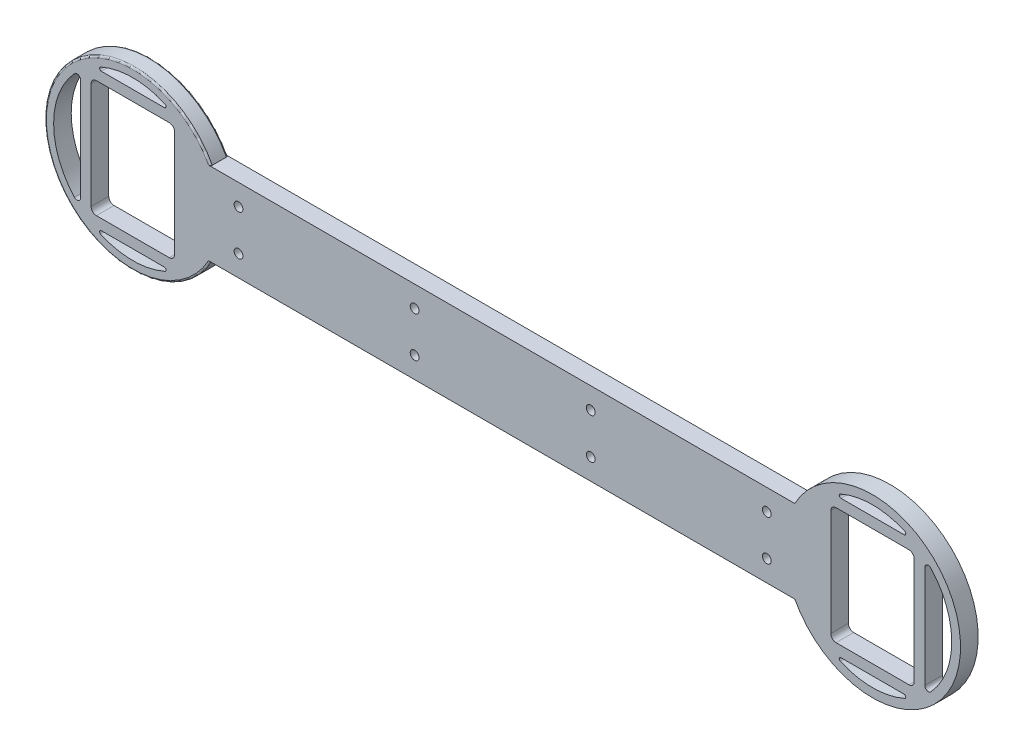
from build123d import *

# Parameters (mm, degrees)
SKETCH_1_W             = 47.4
SKETCH_1_H             = 66.4
SKETCH_1_R             = 2.5
EXTRUDE_1_DEPTH        = 10
FILLET_1_R             = 3
FILLET_2_R             = 2
FILLET_4_R             = 1
FILLET_5_R             = 1
FILLET_1_OF_MIRROR_1_R = 3
FILLET_2_OF_MIRROR_1_R = 2
FILLET_4_OF_MIRROR_1_R = 1


with BuildPart() as part:
    # 草图1 → 凸台-拉伸1 (new body)
    with BuildSketch(Plane.XY):
        with BuildLine():
            ThreePointArc((-165.866679255, 23.5), (-260, 0), (-165.866679255, -23.5))
            Line((-165.866679255, -23.5), (0, -23.5))
            Line((0, -23.5), (0, 23.5))
            Line((0, 23.5), (-165.866679255, 23.5))
        make_face()
        with BuildLine():
            ThreePointArc((-187.901131251, -39.2), (-210, -45), (-232.098868749, -39.2))
            Line((-232.098868749, -39.2), (-187.901131251, -39.2))
        make_face(mode=Mode.SUBTRACT)
        with BuildLine():
            ThreePointArc((-239.7, -33.806951948), (-255, 0), (-239.7, 33.806951948))
            Line((-239.7, 33.806951948), (-239.7, -33.806951948))
        make_face(mode=Mode.SUBTRACT)
        with Locations((-210, 0)):
            Rectangle(SKETCH_1_W, SKETCH_1_H, mode=Mode.SUBTRACT)
        with BuildLine():
            Line((-187.901131251, 39.2), (-232.098868749, 39.2))
            ThreePointArc((-232.098868749, 39.2), (-210, 45), (-187.901131251, 39.2))
        make_face(mode=Mode.SUBTRACT)
        with Locations((-50, 11.5)):
            Circle(SKETCH_1_R, mode=Mode.SUBTRACT)
        with Locations((-150, 11.5)):
            Circle(SKETCH_1_R, mode=Mode.SUBTRACT)
        with Locations((-150, -11.5)):
            Circle(SKETCH_1_R, mode=Mode.SUBTRACT)
        with Locations((-50, -11.5)):
            Circle(SKETCH_1_R, mode=Mode.SUBTRACT)
    extrude_1 = extrude(amount=EXTRUDE_1_DEPTH)

    # 圆角1
    fillet_1_edges = [part.edges().sort_by_distance(p)[0] for p in [
        (-186.3, 33.2, 5),
        (-233.7, 33.2, 5),
        (-233.7, -33.2, 5),
        (-186.3, -33.2, 5),
    ]]
    fillet(fillet_1_edges, radius=FILLET_1_R)

    # 圆角2
    fillet_2_edges = [part.edges().sort_by_distance(p)[0] for p in [
        (-239.7, 33.806951948, 5),
        (-239.7, -33.806951948, 5),
    ]]
    fillet(fillet_2_edges, radius=FILLET_2_R)

    # 圆角4
    fillet_4_edges = [part.edges().sort_by_distance(p)[0] for p in [
        (-187.901131251, 39.2, 5),
        (-232.098868749, 39.2, 5),
        (-187.901131251, -39.2, 5),
        (-232.098868749, -39.2, 5),
    ]]
    fillet(fillet_4_edges, radius=FILLET_4_R)

    # 圆角5
    fillet_5_edges = [part.edges().sort_by_distance(p)[0] for p in [
        (-260, 0, 10),
        (-260, 0, 0),
    ]]
    fillet(fillet_5_edges, radius=FILLET_5_R)

    # 镜向1: 凸台-拉伸1 across plane
    add(extrude_1.mirror(Plane(origin=(0, 0, 10), x_dir=(0, 0, 1), z_dir=(1, 0, 0))))

    # 圆角1 of 镜向1
    fillet_1_of_mirror_1_edges = [part.edges().sort_by_distance(p)[0] for p in [
        (186.3, 33.2, 5),
        (233.7, 33.2, 5),
        (233.7, -33.2, 5),
        (186.3, -33.2, 5),
    ]]
    fillet(fillet_1_of_mirror_1_edges, radius=FILLET_1_OF_MIRROR_1_R)

    # 圆角2 of 镜向1
    fillet_2_of_mirror_1_edges = [part.edges().sort_by_distance(p)[0] for p in [
        (239.7, 33.806951948, 5),
        (239.7, -33.806951948, 5),
    ]]
    fillet(fillet_2_of_mirror_1_edges, radius=FILLET_2_OF_MIRROR_1_R)

    # 圆角4 of 镜向1
    fillet_4_of_mirror_1_edges = [part.edges().sort_by_distance(p)[0] for p in [
        (187.901131251, 39.2, 5),
        (232.098868749, 39.2, 5),
        (187.901131251, -39.2, 5),
        (232.098868749, -39.2, 5),
    ]]
    fillet(fillet_4_of_mirror_1_edges, radius=FILLET_4_OF_MIRROR_1_R)


solid = part.part
